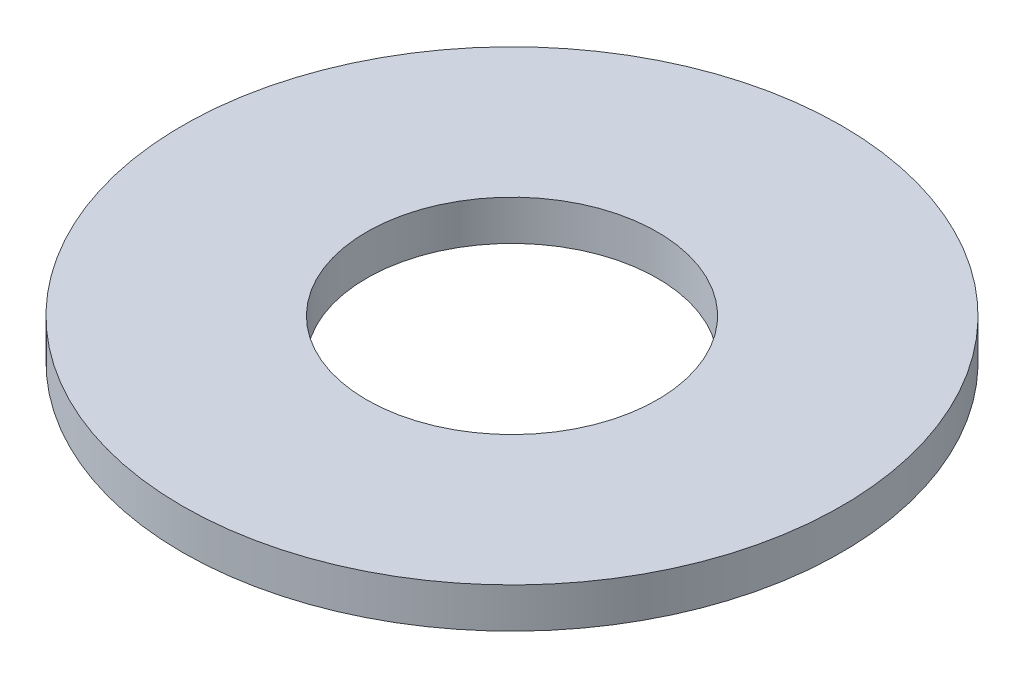
from build123d import *

# Parameters (mm, degrees)
SKETCH1_R           = 25.5
BOSS_EXTRUDE1_DEPTH = 3.1
SKETCH2_R           = 11.25
CUT_EXTRUDE1_DEPTH  = 3.1


with BuildPart() as part:
    # Sketch1 → Boss-Extrude1 (new body)
    with BuildSketch(Plane(origin=(0, 0, 0), x_dir=(1, 0, 0), z_dir=(0, 1, 0))):
        with Locations(Location((0, 0, 0), (0, 0, 90))):
            Circle(SKETCH1_R)
    extrude(amount=BOSS_EXTRUDE1_DEPTH)

    # Sketch2 → Cut-Extrude1 (cut)
    with BuildSketch(Plane(origin=(0, 3.1, 0), x_dir=(1, 0, 0), z_dir=(0, 1, 0))):
        with Locations(Location((0, 0, 0), (0, 0, 270))):
            Circle(SKETCH2_R)
    extrude(amount=-CUT_EXTRUDE1_DEPTH, mode=Mode.SUBTRACT)


solid = part.part
